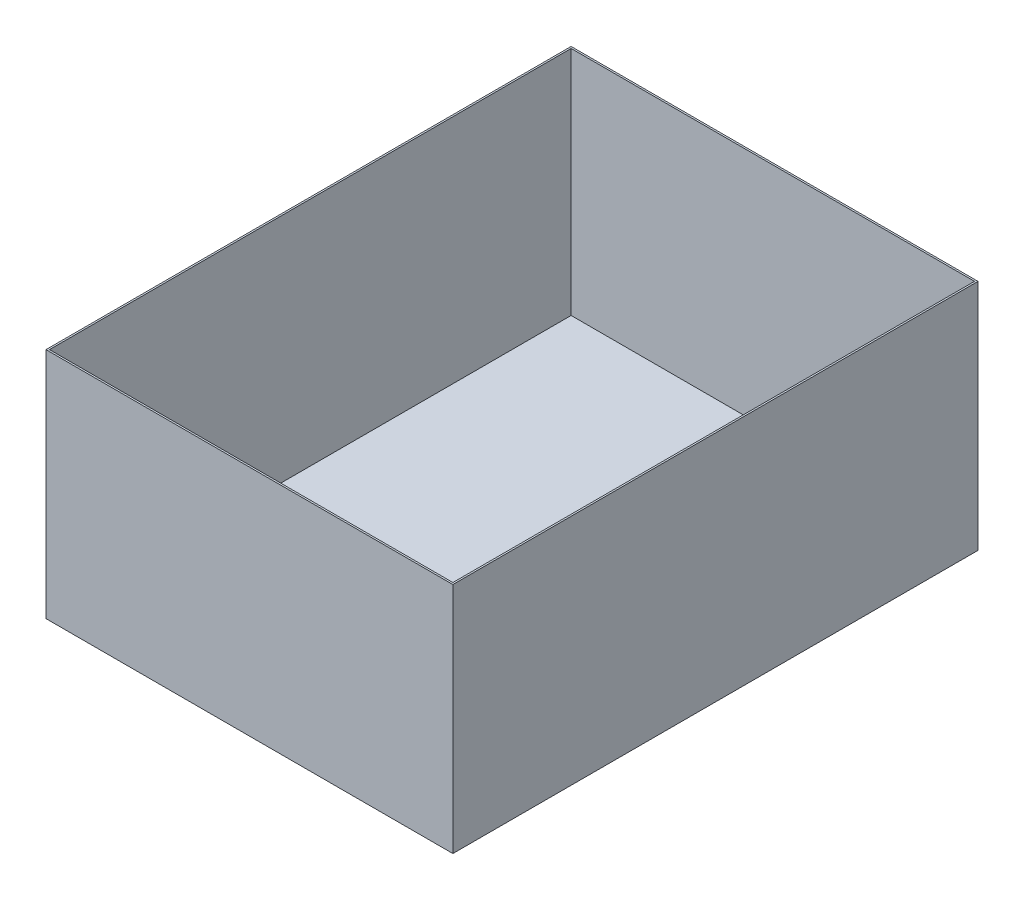
from build123d import *

# Parameters (mm, degrees)
SKETCH1_W           = 117
SKETCH1_H           = 151
BOSS_EXTRUDE1_DEPTH = 33.5
SHELL1_T            = -0.5


with BuildPart() as part:
    # Sketch1 → Boss-Extrude1 (new, symmetric)
    with BuildSketch(Plane(origin=(0, 0, 0), x_dir=(1, 0, 0), z_dir=(0, 1, 0))):
        Rectangle(SKETCH1_W, SKETCH1_H)
    extrude(amount=BOSS_EXTRUDE1_DEPTH, both=True)

    # Shell1
    shell1_openings = [part.faces().sort_by_distance(p)[0] for p in [
        (0, 33.5, 0),
    ]]
    offset(amount=SHELL1_T, openings=shell1_openings, kind=Kind.INTERSECTION)


solid = part.part
